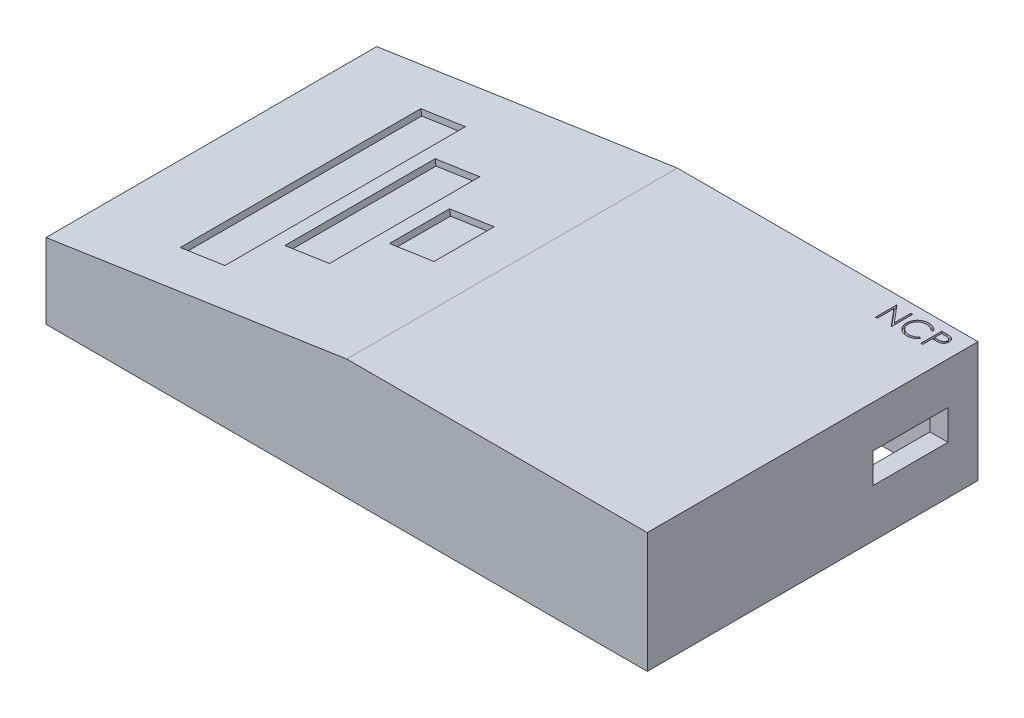
from build123d import *

# Parameters (mm, degrees)
BOSS_EXTRUDE1_DEPTH = 55
SHELL1_T            = -3
SKETCH2_W           = 12.5
SKETCH2_H           = 5
CUT_EXTRUDE1_DEPTH  = 5
SKETCH3_W           = 7.5
SKETCH3_H           = 25
SKETCH3_H_2         = 40
SKETCH3_H_3         = 10
CUT_EXTRUDE2_DEPTH  = 1
CUT_EXTRUDE3_DEPTH  = 0.5
SKETCH5_R           = 2
BOSS_EXTRUDE2_DEPTH = 7.5
SKETCH6_R           = 1.125
BOSS_EXTRUDE3_DEPTH = 5
SKETCH7_W           = 23
SKETCH7_H           = 16.5
BOSS_EXTRUDE4_DEPTH = 2.25
SKETCH8_W           = 1
SKETCH8_H           = 1.85
BOSS_EXTRUDE5_DEPTH = 1


with BuildPart() as part:
    # Sketch1 → Boss-Extrude1 (new body)
    with BuildSketch(Plane.XY):
        Polygon((100, 20), (50, 20), (0, 12.5), (0, 0), (100, 0), align=None)
    extrude(amount=BOSS_EXTRUDE1_DEPTH)

    # Shell1
    shell1_openings = [part.faces().sort_by_distance(p)[0] for p in [
        (50, 0, 27.5),
    ]]
    offset(amount=SHELL1_T, openings=shell1_openings, kind=Kind.INTERSECTION)

    # Sketch2 → Cut-Extrude1 (cut)
    with BuildSketch(Plane(origin=(100, 0, 0), x_dir=(0, 0, -1), z_dir=(1, 0, 0))):
        with Locations((-11.25, 10.5)):
            Rectangle(SKETCH2_W, SKETCH2_H)
    extrude(amount=-CUT_EXTRUDE1_DEPTH, mode=Mode.SUBTRACT)

    # Sketch3 → Cut-Extrude2 (cut)
    with BuildSketch(Plane(origin=(-1.833740831, 12.224938875, 0), x_dir=(0.9889363528682975, 0.14834045293024462, 0), z_dir=(-0.14834045293024462, 0.9889363528682975, 0))):
        with Locations((30.604255662, -27.5)):
            Rectangle(SKETCH3_W, SKETCH3_H)
        with Locations((20.604255662, -27.5)):
            Rectangle(SKETCH3_W, SKETCH3_H_2)
        with Locations((40.604255662, -27.5)):
            Rectangle(SKETCH3_W, SKETCH3_H_3)
    extrude(amount=-CUT_EXTRUDE2_DEPTH, mode=Mode.SUBTRACT)

    # Sketch4 → Cut-Extrude3 (cut)
    # profile 1 of 3: a face of its own
    with BuildSketch(Plane(origin=(0, 20, 0), x_dir=(1, 0, 0), z_dir=(0, 1, 0))):
        Polygon((87.948717949, -5), (87.948717949, -1.5), (88.014623397, -1.5), (90.326923077, -4.254707532), (90.326923077, -1.5), (90.641025641, -1.5), (90.641025641, -5), (90.569511218, -5), (88.262820513, -2.251602564), (88.262820513, -5), align=None)
    # profile 2 of 3: a face of its own
    with BuildSketch(Plane(origin=(0, 20, 0), x_dir=(1, 0, 0), z_dir=(0, 1, 0))):
        with BuildLine():
            Line((94.769230769, -2.142227564), (94.494391026, -2.352564103))
            add(Edge.make_bspline(
                [(94.494391026, -2.352564103), (94.474785137, -2.329198133), (94.43583769, -2.282781217), (94.373178488, -2.217601673), (94.307876845, -2.156536411), (94.239957724, -2.099294531), (94.168198604, -2.047877766), (94.094337806, -1.999606663), (94.01713976, -1.956338925), (93.910388026, -1.903875939), (93.770740178, -1.849129784), (93.594945338, -1.803226552), (93.41143424, -1.774005377), (93.28623664, -1.770840535), (93.22255609, -1.769230769)],
                knots=[0, 0, 0, 0, 0.757959112, 1.505699292, 2.245454638, 2.979532153, 3.711538275, 4.438200793, 5.171680507, 5.909471876, 7.393775596, 8.890124382, 10.418191784, 12, 12, 12, 12], degree=3))
            add(Edge.make_bspline(
                [(93.22255609, -1.769230769), (93.18747279, -1.769634732), (93.117631798, -1.770438908), (93.013983324, -1.781048033), (92.912270273, -1.795959243), (92.812558807, -1.818084566), (92.714975848, -1.846057185), (92.618883446, -1.879482599), (92.525672847, -1.920837439), (92.434054608, -1.966545699), (92.346275397, -2.018173144), (92.26322035, -2.074486496), (92.185192382, -2.134855592), (92.11212977, -2.199506698), (92.043957821, -2.268148659), (91.98117051, -2.341513), (91.9239851, -2.419365174), (91.871268075, -2.500678581), (91.824055342, -2.585216373), (91.784525462, -2.673291444), (91.74952034, -2.763395547), (91.721821097, -2.856546707), (91.699896581, -2.952089473), (91.684768917, -3.050280261), (91.674280446, -3.150913941), (91.673480269, -3.219123253), (91.673076923, -3.253505609)],
                knots=[0, 0, 0, 0, 1.054917814, 2.100044995, 3.131103042, 4.146048494, 5.169673617, 6.183595914, 7.203665975, 8.234915748, 9.262203917, 10.264457458, 11.251630812, 12.227803204, 13.197192746, 14.159520551, 15.12972552, 16.100847026, 17.073214652, 18.039054194, 19.002613845, 19.979014051, 20.95965708, 21.949030935, 22.966165397, 24, 24, 24, 24], degree=3))
            add(Edge.make_bspline(
                [(91.673076923, -3.253505609), (91.674338742, -3.305236929), (91.676816156, -3.406804514), (91.69886449, -3.555575124), (91.732369582, -3.698095798), (91.782585159, -3.83347564), (91.844504209, -3.963383998), (91.922744821, -4.085622852), (92.013361358, -4.202039416), (92.117635778, -4.309882364), (92.232041594, -4.408396089), (92.354789505, -4.495146671), (92.485573793, -4.567461553), (92.622950423, -4.6276375), (92.767976537, -4.673894228), (92.920391339, -4.706458351), (93.079863335, -4.727700532), (93.188832735, -4.72973422), (93.244290865, -4.730769231)],
                knots=[0, 0, 0, 0, 1.029171465, 2.020641659, 2.987623507, 3.938342917, 4.889210282, 5.84687017, 6.821220943, 7.821438502, 8.827599549, 9.822697543, 10.807740252, 11.797342354, 12.80366471, 13.83203677, 14.896651826, 16, 16, 16, 16], degree=3))
            add(Edge.make_bspline(
                [(93.244290865, -4.730769231), (93.305393554, -4.729080451), (93.425658263, -4.725756528), (93.60202629, -4.697597279), (93.770862055, -4.651939362), (93.932174642, -4.588041439), (94.085509288, -4.504976151), (94.231105948, -4.404278274), (94.369087519, -4.284989941), (94.452058801, -4.193906813), (94.494391026, -4.147435897)],
                knots=[0, 0, 0, 0, 1.028121516, 2.023589091, 2.998037872, 3.967518031, 4.937445131, 5.927275754, 6.942489185, 8, 8, 8, 8], degree=3))
            Line((94.494391026, -4.147435897), (94.769230769, -4.355669071))
            add(Edge.make_bspline(
                [(94.769230769, -4.355669071), (94.747112659, -4.384207522), (94.702982384, -4.441147729), (94.631524367, -4.521419438), (94.55624707, -4.596923474), (94.47659136, -4.667051095), (94.393473568, -4.733205561), (94.305401256, -4.793507392), (94.213532223, -4.848798276), (94.118177744, -4.899425201), (94.019439132, -4.944342448), (93.917434697, -4.982796216), (93.812604121, -5.015921105), (93.704942613, -5.043173042), (93.594226856, -5.064444126), (93.480856382, -5.078663801), (93.364586507, -5.088405715), (93.286145085, -5.089293631), (93.246394231, -5.08974359)],
                knots=[0, 0, 0, 0, 0.986787822, 1.968848986, 2.935600012, 3.899624008, 4.868462664, 5.837806735, 6.815139263, 7.798259679, 8.787526145, 9.778297419, 10.776456485, 11.791383307, 12.812564526, 13.85620153, 14.913611965, 16, 16, 16, 16], degree=3))
            add(Edge.make_bspline(
                [(93.246394231, -5.08974359), (93.208750564, -5.089481597), (93.134314874, -5.088963539), (93.024416122, -5.080571372), (92.917426541, -5.069121635), (92.813651915, -5.051881504), (92.71252594, -5.031537164), (92.614965356, -5.004265907), (92.520010145, -4.973716741), (92.428041805, -4.937811754), (92.338982105, -4.897295571), (92.253118294, -4.851504013), (92.170489861, -4.800822148), (92.09028444, -4.746367137), (92.013686857, -4.686389836), (91.940033331, -4.621723201), (91.868910855, -4.55258519), (91.82490817, -4.502730337), (91.802784455, -4.477664263)],
                knots=[0, 0, 0, 0, 1.114604814, 2.203992996, 3.262667896, 4.300477797, 5.318619304, 6.316056647, 7.298880507, 8.271930387, 9.238335007, 10.195173496, 11.151986948, 12.108099108, 13.064862484, 14.031167946, 15.010108607, 16, 16, 16, 16], degree=3))
            add(Edge.make_bspline(
                [(91.802784455, -4.477664263), (91.767348812, -4.434123074), (91.696905335, -4.347566363), (91.606779651, -4.207280382), (91.529632096, -4.060812173), (91.467256175, -3.907392245), (91.418493442, -3.747364857), (91.384712247, -3.580649343), (91.362760643, -3.407401401), (91.360250354, -3.289564612), (91.358974359, -3.229667468)],
                knots=[0, 0, 0, 0, 0.994628077, 1.977248131, 2.950237994, 3.925870899, 4.908910175, 5.911660606, 6.938484602, 8, 8, 8, 8], degree=3))
            add(Edge.make_bspline(
                [(91.358974359, -3.229667468), (91.360529553, -3.166712014), (91.363589299, -3.04285109), (91.389585094, -2.861077137), (91.43140389, -2.686925738), (91.490800779, -2.520721993), (91.56610613, -2.361591713), (91.659132744, -2.210750508), (91.768799886, -2.067233708), (91.894247454, -1.933218957), (92.031814789, -1.810679604), (92.179133603, -1.702873401), (92.33591555, -1.613155885), (92.500433402, -1.538159722), (92.673919083, -1.480515259), (92.856002453, -1.440162072), (93.046341367, -1.415044956), (93.176203793, -1.411869748), (93.2421875, -1.41025641)],
                knots=[0, 0, 0, 0, 1.032925535, 2.032216505, 3.007276963, 3.968222605, 4.92396291, 5.891752235, 6.871517503, 7.883894988, 8.900124299, 9.891468569, 10.874487609, 11.85992873, 12.854644235, 13.869047385, 14.917252991, 16, 16, 16, 16], degree=3))
            add(Edge.make_bspline(
                [(93.2421875, -1.41025641), (93.282401972, -1.410738548), (93.362002469, -1.411692892), (93.479755122, -1.420999035), (93.594397449, -1.436512641), (93.706008431, -1.457628711), (93.815131047, -1.483836032), (93.920931288, -1.51797633), (94.024029975, -1.557012862), (94.123776883, -1.601971328), (94.219693433, -1.652438069), (94.311749751, -1.707853693), (94.39921461, -1.768149498), (94.482703459, -1.832812674), (94.56081967, -1.903211233), (94.635781148, -1.977408829), (94.705042226, -2.057542653), (94.747795421, -2.113947587), (94.769230769, -2.142227564)],
                knots=[0, 0, 0, 0, 1.096760587, 2.17092713, 3.219439832, 4.250915756, 5.268269357, 6.278326846, 7.281116186, 8.274029601, 9.260640565, 10.235837813, 11.203064059, 12.156899882, 13.114053108, 14.069676657, 15.032185724, 16, 16, 16, 16], degree=3))
        make_face()
    # profile 3 of 3: a face of its own
    with BuildSketch(Plane(origin=(0, 20, 0), x_dir=(1, 0, 0), z_dir=(0, 1, 0))):
        with BuildLine():
            Line((95.487179487, -1.5), (96.173577724, -1.5))
            add(Edge.make_bspline(
                [(96.173577724, -1.5), (96.220788631, -1.500051896), (96.311246823, -1.500151332), (96.440961879, -1.503166078), (96.558771611, -1.50719277), (96.664421992, -1.512774663), (96.75823809, -1.519371253), (96.839795389, -1.528623292), (96.909734946, -1.538283588), (96.951641395, -1.548104995), (96.970753205, -1.552584135)],
                knots=[0, 0, 0, 0, 1.415646017, 2.712440637, 3.8905458, 4.950247383, 5.884950622, 6.709939814, 7.411656543, 8, 8, 8, 8], degree=3))
            add(Edge.make_bspline(
                [(96.970753205, -1.552584135), (96.994946739, -1.559206084), (97.042763716, -1.572293946), (97.111664759, -1.59850767), (97.177218605, -1.629589835), (97.239650163, -1.665013775), (97.298192246, -1.706299339), (97.353718287, -1.751772957), (97.405738267, -1.802484525), (97.453959659, -1.857865265), (97.498244457, -1.916985475), (97.53637414, -1.980727705), (97.568301367, -2.048019008), (97.595684638, -2.118812579), (97.615393093, -2.193702903), (97.630239992, -2.272169615), (97.63966362, -2.354204305), (97.640566182, -2.410264173), (97.641025641, -2.438802083)],
                knots=[0, 0, 0, 0, 0.999701418, 1.975846123, 2.934577507, 3.890451536, 4.834027766, 5.787354733, 6.749476667, 7.726910423, 8.712836071, 9.690891519, 10.682875813, 11.679750201, 12.712814741, 13.765529915, 14.8625177, 16, 16, 16, 16], degree=3))
            add(Edge.make_bspline(
                [(97.641025641, -2.438802083), (97.640604216, -2.46757986), (97.63977967, -2.523885524), (97.629883385, -2.606258312), (97.616553193, -2.684976702), (97.596056141, -2.759866153), (97.569210468, -2.830481923), (97.537718415, -2.897903155), (97.499734885, -2.960982827), (97.456090055, -3.019949945), (97.407538461, -3.074859857), (97.354285523, -3.125314652), (97.29654623, -3.17101899), (97.234504082, -3.212075334), (97.167554233, -3.247531613), (97.09671208, -3.279288918), (97.021361863, -3.305959979), (96.969219349, -3.31999004), (96.942708333, -3.327123397)],
                knots=[0, 0, 0, 0, 1.121902311, 2.195077645, 3.232258892, 4.234102512, 5.217864754, 6.176164875, 7.132989551, 8.084763148, 9.034132444, 9.988522005, 10.94243251, 11.903244335, 12.886203696, 13.894208494, 14.929344452, 16, 16, 16, 16], degree=3))
            add(Edge.make_bspline(
                [(96.942708333, -3.327123397), (96.920780999, -3.331786379), (96.872725972, -3.342005573), (96.79358325, -3.35341403), (96.701437864, -3.36315163), (96.596415584, -3.370452768), (96.478610679, -3.376703136), (96.347959422, -3.38167123), (96.204205345, -3.384401084), (96.1039341, -3.384541877), (96.051582532, -3.384615385)],
                knots=[0, 0, 0, 0, 0.601384939, 1.31797006, 2.144135048, 3.087295005, 4.142315834, 5.309527816, 6.595305764, 8, 8, 8, 8], degree=3))
            Line((96.051582532, -3.384615385), (95.801282051, -3.384615385))
            Line((95.801282051, -3.384615385), (95.801282051, -5))
            Line((95.801282051, -5), (95.487179487, -5))
            Line((95.487179487, -5), (95.487179487, -1.5))
        make_face()
        with BuildLine():
            Line((95.801282051, -1.858974359), (95.801282051, -3.025641026))
            Line((95.801282051, -3.025641026), (96.4140625, -3.033353365))
            add(Edge.make_bspline(
                [(96.4140625, -3.033353365), (96.443982426, -3.033368829), (96.501742226, -3.033398681), (96.585178449, -3.029413458), (96.662587736, -3.024812925), (96.733732312, -3.018077002), (96.798644246, -3.008555744), (96.857431775, -2.998944006), (96.909639058, -2.985038644), (96.97073826, -2.966315574), (97.038821607, -2.934382959), (97.112889156, -2.888033069), (97.175659742, -2.82895236), (97.229978039, -2.762524529), (97.273083917, -2.6886254), (97.304639909, -2.609556463), (97.323181066, -2.526128613), (97.32566726, -2.469040475), (97.326923077, -2.440204327)],
                knots=[0, 0, 0, 0, 1.160613943, 2.240541288, 3.23993089, 4.169200891, 5.011653406, 5.7853311, 6.478053781, 7.106038997, 8.262395093, 9.384106736, 10.481365981, 11.59014053, 12.70357646, 13.786202915, 14.881775077, 16, 16, 16, 16], degree=3))
            add(Edge.make_bspline(
                [(97.326923077, -2.440204327), (97.32566043, -2.412065813), (97.323150445, -2.356129931), (97.304494582, -2.274151171), (97.273145268, -2.195915466), (97.229688674, -2.122942381), (97.176947544, -2.056753577), (97.115648201, -1.99925645), (97.04593494, -1.953034747), (96.981086708, -1.923201466), (96.923485522, -1.90498619), (96.873453563, -1.89224135), (96.816962888, -1.882065743), (96.753995109, -1.873826241), (96.685038275, -1.866772779), (96.60949996, -1.861986802), (96.527666317, -1.859185346), (96.470855746, -1.859046391), (96.44140625, -1.858974359)],
                knots=[0, 0, 0, 0, 1.120700087, 2.227813068, 3.331159281, 4.466773991, 5.599788987, 6.693661531, 7.80175334, 8.91857717, 9.525282508, 10.207424825, 10.974604443, 11.810962634, 12.737642355, 13.736264703, 14.826523623, 16, 16, 16, 16], degree=3))
            Line((96.44140625, -1.858974359), (95.801282051, -1.858974359))
        make_face(mode=Mode.SUBTRACT)
    extrude(amount=-CUT_EXTRUDE3_DEPTH, mode=Mode.SUBTRACT)

    # Sketch5 → Boss-Extrude2 (add)
    with BuildSketch(Plane.XZ.offset(-17)):
        with Locations(Location((93.75, 27.75, 0), (0, 0, 90))):
            Circle(SKETCH5_R)
        with Locations(Location((67.25, 46.25, 0), (0, 0, 90))):
            Circle(SKETCH5_R)
    extrude(amount=BOSS_EXTRUDE2_DEPTH)

    # Sketch6 → Boss-Extrude3 (add)
    with BuildSketch(Plane.XZ.offset(-9.5)):
        with Locations(Location((67.25, 46.25, 0), (0, 0, 270))):
            Circle(SKETCH6_R)
        with Locations(Location((93.75, 27.75, 0), (0, 0, 270))):
            Circle(SKETCH6_R)
    extrude(amount=BOSS_EXTRUDE3_DEPTH)

    # Sketch7 → Boss-Extrude4 (add)
    with BuildSketch(Plane.XZ.offset(-17)):
        with Locations((85.5, 11.25)):
            Rectangle(SKETCH7_W, SKETCH7_H)
    extrude(amount=BOSS_EXTRUDE4_DEPTH)

    # Sketch8 → Boss-Extrude5 (add)
    with BuildSketch(Plane.XZ.offset(-14.75)):
        Polygon((75, 7.65), (74, 7.65), (74, 3), (80.25, 3), (80.25, 7.65), align=None)
        with Locations((74.5, 13.925)):
            Rectangle(SKETCH8_W, SKETCH8_H)
        Polygon((80.25, 19.5), (74, 19.5), (74, 14.85), (75, 14.85), (80.25, 14.85), align=None)
        with Locations((74.5, 8.575)):
            Rectangle(SKETCH8_W, SKETCH8_H)
    extrude(amount=BOSS_EXTRUDE5_DEPTH)


solid = part.part
